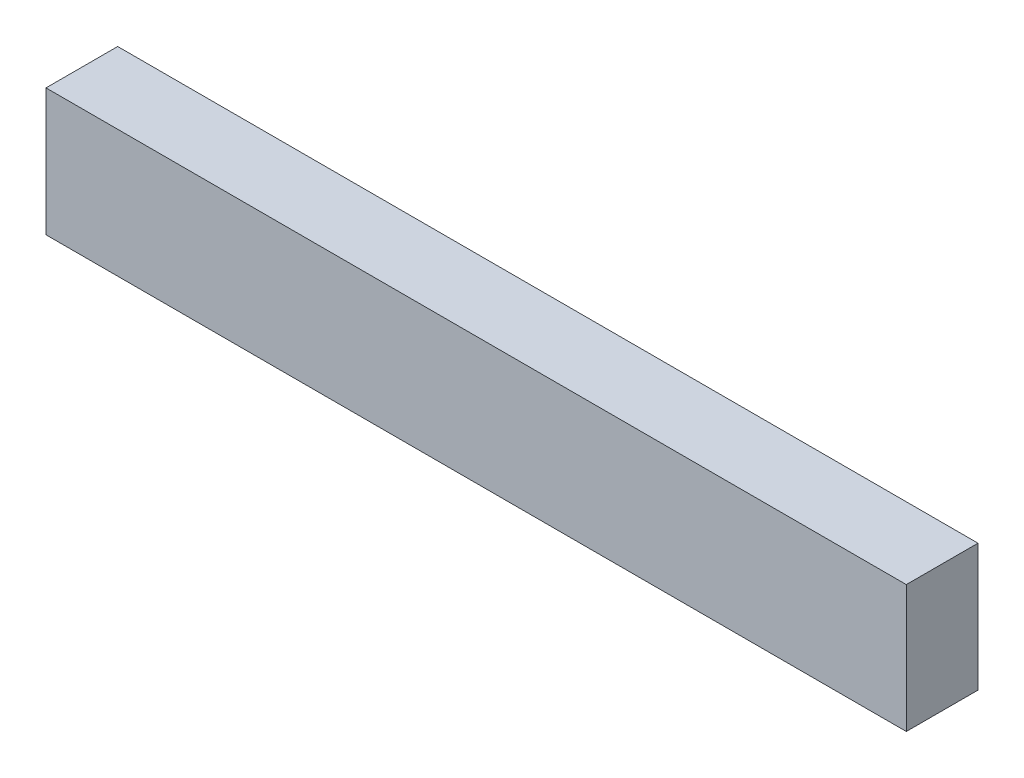
from build123d import *

# Parameters (mm, degrees)
SKETCH1_W           = 48
SKETCH1_H           = 7.1
BOSS_EXTRUDE1_DEPTH = 4


with BuildPart() as part:
    # Sketch1 → Boss-Extrude1 (new body)
    with BuildSketch(Plane.XY):
        Rectangle(SKETCH1_W, SKETCH1_H)
    extrude(amount=BOSS_EXTRUDE1_DEPTH)


solid = part.part
